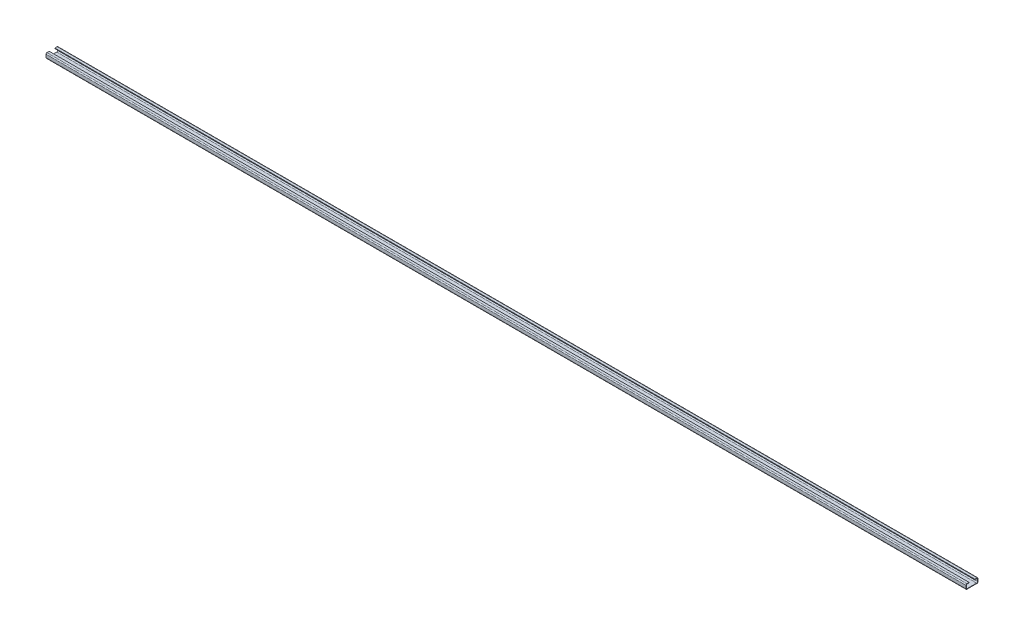
from build123d import *

# Parameters (mm, degrees)
RESSALTO_EXTRUS_O1_DEPTH = 5700
FILETE1_R                = 6


with BuildPart() as part:
    # Esboço1 → Ressalto-extrusão1 (new body)
    with BuildSketch(Plane(origin=(0, 0, 0), x_dir=(0, 0, -1), z_dir=(1, 0, 0))):
        Polygon((-34.75, 12.25), (-34.75, -12.25), (34.75, -12.25), (34.75, 12.25), (17.5, 12.25), (17.5, 15), (37.5, 15), (37.5, -15), (-37.5, -15), (-37.5, 15), (-17.5, 15), (-17.5, 12.25), align=None)
    extrude(amount=RESSALTO_EXTRUS_O1_DEPTH)

    # Filete1
    filete1_edges = [part.edges().sort_by_distance(p)[0] for p in [
        (2850, -15, -37.5),
        (2850, -15, 37.5),
        (2850, 15, 37.5),
        (2850, 12.25, 34.75),
        (2850, -12.25, 34.75),
        (2850, -12.25, -34.75),
        (2850, 12.25, -34.75),
        (2850, 15, -37.5),
    ]]
    fillet(filete1_edges, radius=FILETE1_R)


solid = part.part
